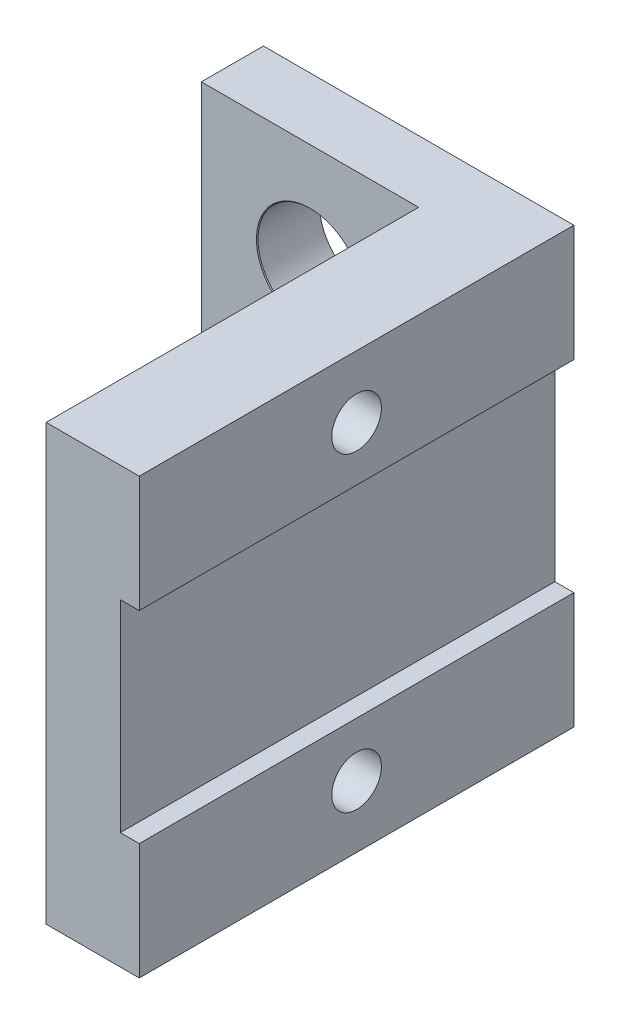
from build123d import *

# Parameters (mm, degrees)
BOSS_EXTRUDE1_DEPTH            = 14
M3_CLEARANCE_HOLE1_D           = 3.4
M3_CLEARANCE_HOLE1_CSINK_D     = 3.45
M3_CLEARANCE_HOLE1_CSINK_ANGLE = 90
SKETCH2_W                      = 0.61
SKETCH2_H                      = 6.5
CUT_EXTRUDE1_DEPTH             = 23.181073013
M2_TAPPED_HOLE1_D              = 1.6


with BuildPart() as part:
    # Sketch1 → Boss-Extrude1 (new body)
    with BuildSketch(Plane(origin=(0, 0, 0), x_dir=(1, 0, 0), z_dir=(0, 1, 0))):
        Polygon((-10, 0), (0, 0), (0, -14), (-3, -14), (-3, -2), (-10, -2), align=None)
    extrude(amount=BOSS_EXTRUDE1_DEPTH)

    # M3 Clearance Hole1 (through all)
    with Locations(Plane.XY.offset(2)):
        with Locations((-6.5, 10.5), (-6.5, 3.5)):
            CounterSinkHole(M3_CLEARANCE_HOLE1_D / 2, M3_CLEARANCE_HOLE1_CSINK_D / 2, counter_sink_angle=M3_CLEARANCE_HOLE1_CSINK_ANGLE)

    # Sketch2 → Cut-Extrude1 (cut, through all)
    with BuildSketch(Plane.XY.offset(14)):
        with Locations((-0.305, 7)):
            Rectangle(SKETCH2_W, SKETCH2_H)
    extrude(amount=-CUT_EXTRUDE1_DEPTH, mode=Mode.SUBTRACT)

    # M2 Tapped Hole1 (through all)
    with Locations(Plane(origin=(0, 5.858814373, -1.158558045), x_dir=(0, 0, 1), z_dir=(1, 0, 0))):
        with Locations((8.158558045, -6.141185627), (8.158558045, 3.858814373)):
            Hole(M2_TAPPED_HOLE1_D / 2)


solid = part.part
